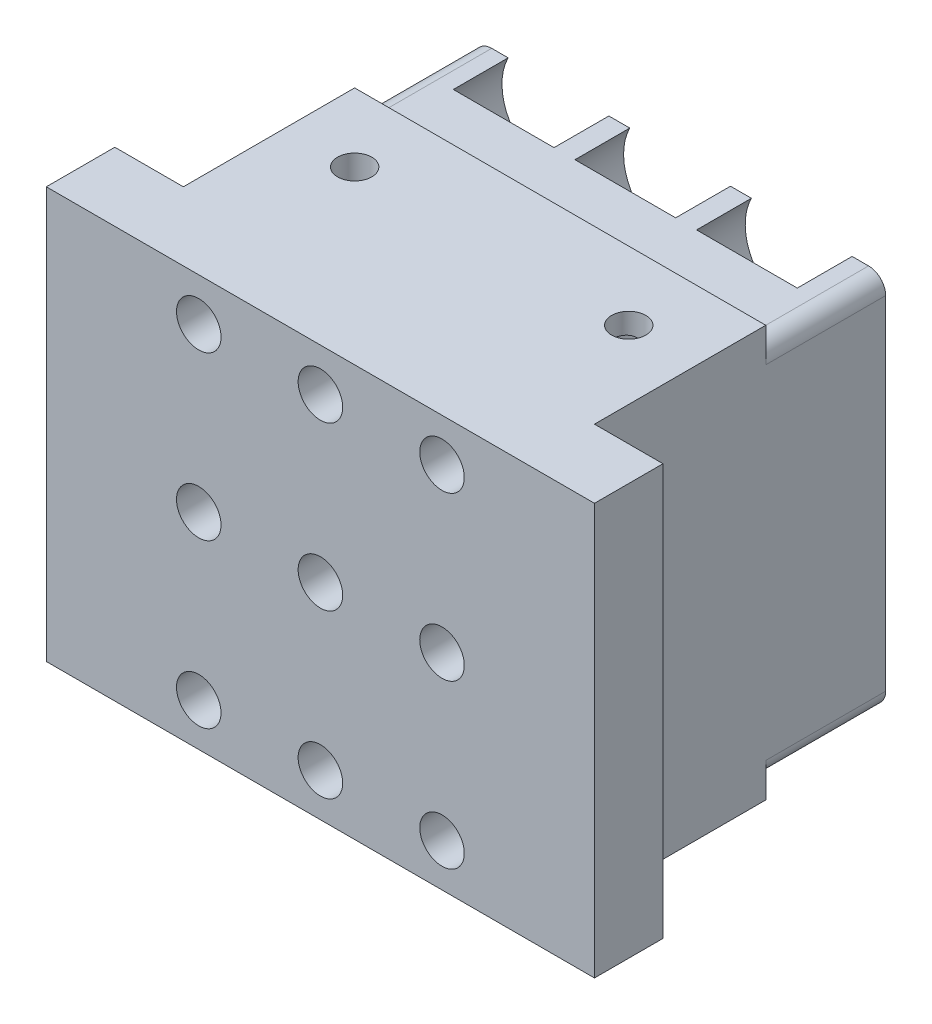
from build123d import *

# Parameters (mm, degrees)
BOSS_EXTRUDE1_DEPTH     = 12
BOSS_EXTRUDE2_DEPTH     = 10.5
CUT_EXTRUDE1_DEPTH      = 18.839562775
CUT_EXTRUDE1_DEPTH_BACK = 18.839562775
SKETCH2_R               = 0.5
SKETCH5_R               = 1.65
CUT_EXTRUDE2_DEPTH      = 1.6
CUT_EXTRUDE5_DEPTH      = 17.947271167
CUT_EXTRUDE5_DEPTH_BACK = 17.947271167
SKETCH7_R               = 0.65


with BuildPart() as part:
    # Sketch1 → Boss-Extrude1 (new body)
    with BuildSketch(Plane(origin=(0, 0, 0), x_dir=(1, 0, 0), z_dir=(0, 1, 0))):
        Polygon((0, 0), (8, 0), (8, 2), (6, 2), (6, 7), (-6, 7), (-6, 2), (-8, 2), (-8, 0), align=None)
    extrude(amount=BOSS_EXTRUDE1_DEPTH)

    # Sketch4 → Boss-Extrude2 (add)
    with BuildSketch(Plane.XY):
        with BuildLine():
            Line((-6, 11), (-6, 1))
            ThreePointArc((-6, 1), (-5.853553391, 0.646446609), (-5.5, 0.5))
            Line((-5.5, 0.5), (5.5, 0.5))
            ThreePointArc((5.5, 0.5), (5.853553391, 0.646446609), (6, 1))
            Line((6, 1), (6, 11))
            ThreePointArc((6, 11), (5.853553391, 11.353553391), (5.5, 11.5))
            Line((5.5, 11.5), (-5.5, 11.5))
            ThreePointArc((-5.5, 11.5), (-5.853553391, 11.353553391), (-6, 11))
        make_face()
    extrude(amount=-BOSS_EXTRUDE2_DEPTH)

    # Sketch2 → Cut-Extrude1 (cut, two sides: drawn at the far end of the back side and taken through both)
    with BuildSketch(Plane(origin=(0, 12, 0), x_dir=(1, 0, 0), z_dir=(0, 1, 0)).offset(-CUT_EXTRUDE1_DEPTH_BACK)):
        with Locations(Location((-4, 5, 0), (0, 0, 270))):
            Circle(SKETCH2_R)
        with Locations(Location((4, 5, 0), (0, 0, 270))):
            Circle(SKETCH2_R)
    extrude(amount=CUT_EXTRUDE1_DEPTH + CUT_EXTRUDE1_DEPTH_BACK, mode=Mode.SUBTRACT)

    # Sketch5 → Cut-Extrude2 (cut)
    with BuildSketch(Plane(origin=(0, 0, -10.5), x_dir=(-1, 0, 0), z_dir=(0, 0, -1))):
        with Locations((3.55, 6)):
            Circle(SKETCH5_R)
        with Locations((-3.55, 6)):
            Circle(SKETCH5_R)
        with Locations((0, 6)):
            Circle(SKETCH5_R)
        with Locations((-3.55, 10.75)):
            Circle(SKETCH5_R)
        with Locations((0, 10.75)):
            Circle(SKETCH5_R)
        with Locations((3.55, 10.75)):
            Circle(SKETCH5_R)
        with Locations((-3.55, 1.25)):
            Circle(SKETCH5_R)
        with Locations((0, 1.25)):
            Circle(SKETCH5_R)
        with Locations((3.55, 1.25)):
            Circle(SKETCH5_R)
    extrude(amount=-CUT_EXTRUDE2_DEPTH, mode=Mode.SUBTRACT)

    # Sketch7 → Cut-Extrude5 (cut, two sides: drawn at the far end of the back side and taken through both)
    with BuildSketch(Plane(origin=(0, 0, -8.9), x_dir=(-1, 0, 0), z_dir=(0, 0, -1)).offset(-CUT_EXTRUDE5_DEPTH_BACK)):
        with Locations((-3.55, 6)):
            Circle(SKETCH7_R)
        with Locations((3.55, 6)):
            Circle(SKETCH7_R)
        with Locations((0, 6)):
            Circle(SKETCH7_R)
        with Locations((-3.55, 1.25)):
            Circle(SKETCH7_R)
        with Locations((0, 1.25)):
            Circle(SKETCH7_R)
        with Locations((3.55, 1.25)):
            Circle(SKETCH7_R)
        with Locations((3.55, 10.75)):
            Circle(SKETCH7_R)
        with Locations((0, 10.75)):
            Circle(SKETCH7_R)
        with Locations((-3.55, 10.75)):
            Circle(SKETCH7_R)
    extrude(amount=CUT_EXTRUDE5_DEPTH + CUT_EXTRUDE5_DEPTH_BACK, mode=Mode.SUBTRACT)


solid = part.part
